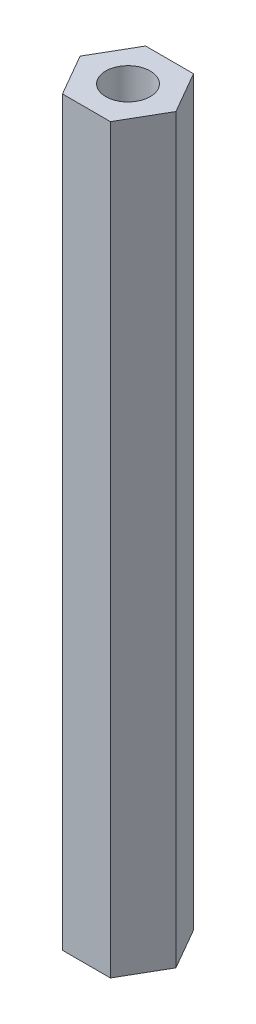
from build123d import *

# Parameters (mm, degrees)
SKETCH_1_R      = 1.5
EXTRUDE_1_DEPTH = 50


with BuildPart() as part:
    # 草图1 → 凸台-拉伸1 (new body)
    with BuildSketch(Plane(origin=(0, 0, 0), x_dir=(1, 0, 0), z_dir=(0, 1, 0))):
        Polygon((1.61820687, 2.799060532), (-1.614954092, 2.800938524), (-3.233160962, 0.001877992), (-1.61820687, -2.799060532), (1.614954092, -2.800938524), (3.233160962, -0.001877992), align=None)
        with Locations(Location((0, 0, 0), (0, 0, 270))):
            Circle(SKETCH_1_R, mode=Mode.SUBTRACT)
    extrude(amount=EXTRUDE_1_DEPTH)


solid = part.part
